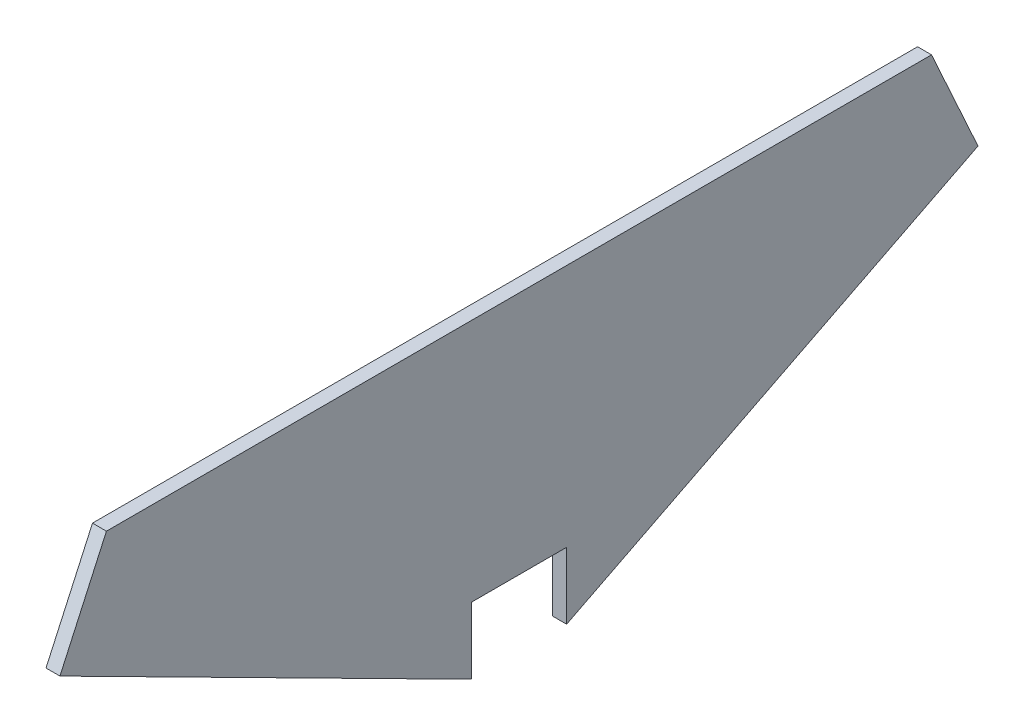
from build123d import *

# Parameters (mm, degrees)
BOSS_EXTRUDE1_DEPTH = 6


with BuildPart() as part:
    # Sketch1 → Boss-Extrude1 (new body)
    with BuildSketch(Plane(origin=(0, 0, 0), x_dir=(0, 0, -1), z_dir=(1, 0, 0))):
        Polygon((173.446617491, 74.110460295), (-181.553382509, 74.110460295), (-201.553382509, 30.110460295), (-24.553382509, -59.565970117), (-24.553382509, -30.889539705), (16.446617491, -30.889539705), (16.446617491, -59.565970117), (193.446617491, 30.110460295), align=None)
    extrude(amount=BOSS_EXTRUDE1_DEPTH)


solid = part.part
